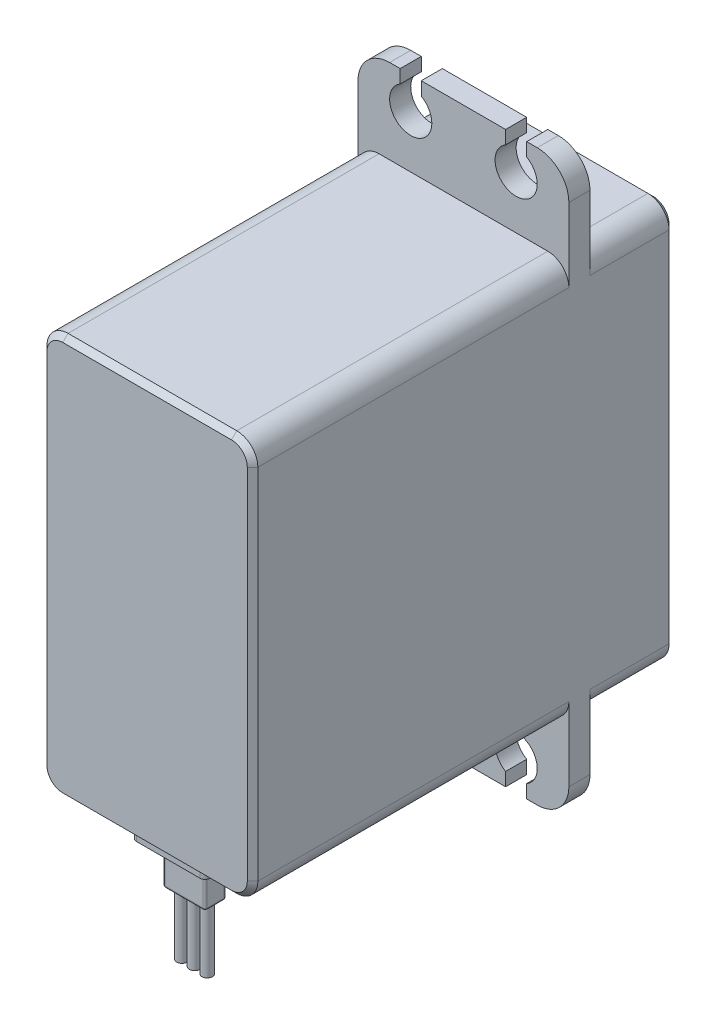
from build123d import *

# Parameters (mm, degrees)
SKETCH_1_W           = 20
SKETCH_1_H           = 54
EXTRUDE_1_DEPTH      = 40
SKETCH_2_OUTSIDE_W   = 36.022
SKETCH_2_OUTSIDE_H   = 70.022
SKETCH_2_OUTSIDE_W_2 = 20
SKETCH_2_OUTSIDE_H_2 = 38
CUT_EXTRUDE_1_DEPTH  = 30
SKETCH_3_OUTSIDE_W   = 36.022
SKETCH_3_OUTSIDE_H   = 70.022
SKETCH_3_OUTSIDE_W_2 = 20
SKETCH_3_OUTSIDE_H_2 = 38
CUT_EXTRUDE_2_DEPTH  = 8
CUT_EXTRUDE_3_DEPTH  = 42.581245773
SKETCH_6_W           = 7
SKETCH_6_H           = 5
EXTRUDE_2_DEPTH      = 2
SKETCH_7_W           = 4
SKETCH_7_H           = 2
EXTRUDE_3_DEPTH      = 4
SKETCH_8_R           = 0.5
EXTRUDE_4_DEPTH      = 6
SKETCH_9_R           = 6.5
EXTRUDE_5_DEPTH      = 2
SKETCH_10_R          = 5
CUT_EXTRUDE_4_DEPTH  = 0.8
SKETCH_11_R          = 2.5
CUT_EXTRUDE_5_DEPTH  = 4
SKETCH_12_R          = 2.5
EXTRUDE_6_DEPTH      = 10
CUT_EXTRUDE_6_DEPTH  = 58.348408871
FILLET_1_R           = 2
CHAMFER_1_SIZE       = 0.5
FILLET_2_R           = 3
FILLET_3_R           = 0.5
FILLET_4_R           = 0.2


with BuildPart() as part:
    # 草图1 → 凸台-拉伸1 (new body)
    with BuildSketch(Plane.XY):
        Rectangle(SKETCH_1_W, SKETCH_1_H)
    extrude(amount=EXTRUDE_1_DEPTH)

    # 草图2 outside → 切除-拉伸1 (cut)
    with BuildSketch(Plane.XY.offset(40)):
        Rectangle(SKETCH_2_OUTSIDE_W, SKETCH_2_OUTSIDE_H)
        Rectangle(SKETCH_2_OUTSIDE_W_2, SKETCH_2_OUTSIDE_H_2, mode=Mode.SUBTRACT)
    extrude(amount=-CUT_EXTRUDE_1_DEPTH, mode=Mode.SUBTRACT)

    # 草图3 outside → 切除-拉伸2 (cut)
    with BuildSketch(Plane(origin=(0, 0, 0), x_dir=(-1, 0, 0), z_dir=(0, 0, -1))):
        Rectangle(SKETCH_3_OUTSIDE_W, SKETCH_3_OUTSIDE_H)
        Rectangle(SKETCH_3_OUTSIDE_W_2, SKETCH_3_OUTSIDE_H_2, mode=Mode.SUBTRACT)
    extrude(amount=-CUT_EXTRUDE_2_DEPTH, mode=Mode.SUBTRACT)

    # 草图4 → 切除-拉伸3 (cut, through all)
    with BuildSketch(Plane.XY.offset(10)):
        with BuildLine():
            Line((4, 25.732050808), (4, 27))
            Line((4, 27), (6, 27))
            Line((6, 27), (6, 25.732050808))
            ThreePointArc((6, 25.732050808), (5, 22), (4, 25.732050808))
        make_face()
        with BuildLine():
            Line((-6, 25.732050808), (-6, 27))
            Line((-6, 27), (-4, 27))
            Line((-4, 27), (-4, 25.732050808))
            ThreePointArc((-4, 25.732050808), (-5, 22), (-6, 25.732050808))
        make_face()
    cut_extrude_3 = extrude(amount=-CUT_EXTRUDE_3_DEPTH, mode=Mode.SUBTRACT)

    # 镜向1: 切除-拉伸3 across plane
    add(cut_extrude_3.mirror(Plane.ZX), mode=Mode.SUBTRACT)

    # 草图6 → 凸台-拉伸2 (add)
    with BuildSketch(Plane.XZ.offset(19)):
        with Locations((0, 35.5)):
            Rectangle(SKETCH_6_W, SKETCH_6_H)
    extrude(amount=EXTRUDE_2_DEPTH)

    # 草图7 → 凸台-拉伸3 (add)
    with BuildSketch(Plane.XZ.offset(21)):
        with Locations((0, 35.5)):
            Rectangle(SKETCH_7_W, SKETCH_7_H)
    extrude(amount=EXTRUDE_3_DEPTH)

    # 草图8 → 凸台-拉伸4 (add)
    with BuildSketch(Plane.XZ.offset(25)):
        with Locations(Location((1.2, 35.5, 0), (0, 0, 90))):
            Circle(SKETCH_8_R)
        with Locations(Location((0, 35.5, 0), (0, 0, 90))):
            Circle(SKETCH_8_R)
        with Locations(Location((-1.2, 35.5, 0), (0, 0, 90))):
            Circle(SKETCH_8_R)
    extrude(amount=EXTRUDE_4_DEPTH)

    # 草图9 → 凸台-拉伸5 (add)
    with BuildSketch(Plane(origin=(0, 0, 0), x_dir=(-1, 0, 0), z_dir=(0, 0, -1))):
        with Locations((0, -9)):
            Circle(SKETCH_9_R)
    extrude(amount=EXTRUDE_5_DEPTH)

    # 草图10 → 切除-拉伸4 (cut)
    with BuildSketch(Plane(origin=(0, 0, -2), x_dir=(-1, 0, 0), z_dir=(0, 0, -1))):
        with Locations((0, -9)):
            Circle(SKETCH_10_R)
    extrude(amount=-CUT_EXTRUDE_4_DEPTH, mode=Mode.SUBTRACT)

    # 草图11 → 切除-拉伸5 (cut)
    with BuildSketch(Plane(origin=(0, 0, -1.2), x_dir=(-1, 0, 0), z_dir=(0, 0, -1))):
        with Locations((0, -9)):
            Circle(SKETCH_11_R)
    extrude(amount=-CUT_EXTRUDE_5_DEPTH, mode=Mode.SUBTRACT)

    # 圆角1
    fillet_1_edges = [part.edges().sort_by_distance(p)[0] for p in [
        (10, -19, 25),
        (-10, -19, 25),
        (-10, 19, 25),
        (10, 19, 25),
        (-10, -19, 4),
        (10, -19, 4),
        (10, 19, 4),
        (-10, 19, 4),
    ]]
    fillet(fillet_1_edges, radius=FILLET_1_R)

    # 倒角1
    chamfer_1_edges = [part.edges().sort_by_distance(p)[0] for p in [
        (6.5, -9, -2),
        (0, -19, 0),
        (10, 0, 0),
        (-10, 0, 0),
        (0, 19, 0),
        (9.414213562, 18.414213562, 0),
        (-9.414213562, 18.414213562, 0),
        (9.414213562, -18.414213562, 0),
        (-9.414213562, -18.414213562, 0),
        (-10, 0, 40),
        (0, -19, 40),
        (10, 0, 40),
        (0, 19, 40),
        (9.414213562, 18.414213562, 40),
        (-9.414213562, 18.414213562, 40),
        (9.414213562, -18.414213562, 40),
        (-9.414213562, -18.414213562, 40),
    ]]
    chamfer(chamfer_1_edges, length=CHAMFER_1_SIZE)

    # 圆角2
    fillet_2_edges = [part.edges().sort_by_distance(p)[0] for p in [
        (10, -27, 9),
        (-10, -27, 9),
        (-10, 27, 9),
        (10, 27, 9),
    ]]
    fillet(fillet_2_edges, radius=FILLET_2_R)

    # 圆角3
    fillet_3_edges = [part.edges().sort_by_distance(p)[0] for p in [
        (-3.5, -20, 38),
        (-3.5, -20, 33),
        (3.5, -20, 33),
        (3.5, -20, 38),
    ]]
    fillet(fillet_3_edges, radius=FILLET_3_R)

    # 圆角4
    fillet_4_edges = [part.edges().sort_by_distance(p)[0] for p in [
        (2, -23, 34.5),
        (2, -23, 36.5),
        (-2, -23, 36.5),
        (-2, -23, 34.5),
        (2, -25, 35.5),
        (0, -25, 36.5),
        (-2, -25, 35.5),
        (0, -25, 34.5),
    ]]
    fillet(fillet_4_edges, radius=FILLET_4_R)


with BuildPart() as body_2:
    # 草图12 → 凸台-拉伸6 (new body)
    with BuildSketch(Plane(origin=(0, 0, 2.8), x_dir=(-1, 0, 0), z_dir=(0, 0, -1))):
        with Locations((0, -9)):
            Circle(SKETCH_12_R)
    extrude(amount=EXTRUDE_6_DEPTH)

    # 草图13 → 切除-拉伸6 (cut, through all)
    with BuildSketch(Plane(origin=(0, 0, -7.2), x_dir=(-1, 0, 0), z_dir=(0, 0, -1))):
        with BuildLine():
            Line((-0.27961852, -6.515686517), (0, -7))
            Line((0, -7), (0.27961852, -6.515686517))
            ThreePointArc((0.27961852, -6.515686517), (0, -6.5), (-0.27961852, -6.515686517))
        make_face()
        with BuildLine():
            Line((0.50176207, -6.550870599), (0.618033989, -7.097886967))
            Line((0.618033989, -7.097886967), (1.033628101, -6.723684348))
            ThreePointArc((1.033628101, -6.723684348), (0.772542486, -6.622358709), (0.50176207, -6.550870599))
        make_face()
        with BuildLine():
            Line((1.234026693, -6.82579253), (1.175570505, -7.381966011))
            Line((1.175570505, -7.381966011), (1.686458962, -7.154503815))
            ThreePointArc((1.686458962, -7.154503815), (1.469463131, -6.977457514), (1.234026693, -6.82579253))
        make_face()
        with BuildLine():
            Line((1.845496185, -7.313541038), (1.618033989, -7.824429495))
            Line((1.618033989, -7.824429495), (2.17420747, -7.765973307))
            ThreePointArc((2.17420747, -7.765973307), (2.022542486, -7.530536869), (1.845496185, -7.313541038))
        make_face()
        with BuildLine():
            Line((2.276315652, -7.966371899), (1.902113033, -8.381966011))
            Line((1.902113033, -8.381966011), (2.449129401, -8.49823793))
            ThreePointArc((2.449129401, -8.49823793), (2.377641291, -8.227457514), (2.276315652, -7.966371899))
        make_face()
        with BuildLine():
            Line((2.484313483, -8.72038148), (2, -9))
            Line((2, -9), (2.484313483, -9.27961852))
            ThreePointArc((2.484313483, -9.27961852), (2.5, -9), (2.484313483, -8.72038148))
        make_face()
        with BuildLine():
            Line((2.449129401, -9.50176207), (1.902113033, -9.618033989))
            Line((1.902113033, -9.618033989), (2.276315652, -10.033628101))
            ThreePointArc((2.276315652, -10.033628101), (2.377641291, -9.772542486), (2.449129401, -9.50176207))
        make_face()
        with BuildLine():
            Line((2.17420747, -10.234026693), (1.618033989, -10.175570505))
            Line((1.618033989, -10.175570505), (1.845496185, -10.686458962))
            ThreePointArc((1.845496185, -10.686458962), (2.022542486, -10.469463131), (2.17420747, -10.234026693))
        make_face()
        with BuildLine():
            Line((1.686458962, -10.845496185), (1.175570505, -10.618033989))
            Line((1.175570505, -10.618033989), (1.234026693, -11.17420747))
            ThreePointArc((1.234026693, -11.17420747), (1.469463131, -11.022542486), (1.686458962, -10.845496185))
        make_face()
        with BuildLine():
            Line((1.033628101, -11.276315652), (0.618033989, -10.902113033))
            Line((0.618033989, -10.902113033), (0.50176207, -11.449129401))
            ThreePointArc((0.50176207, -11.449129401), (0.772542486, -11.377641291), (1.033628101, -11.276315652))
        make_face()
        with BuildLine():
            Line((0.27961852, -11.484313483), (0, -11))
            Line((0, -11), (-0.27961852, -11.484313483))
            ThreePointArc((-0.27961852, -11.484313483), (0, -11.5), (0.27961852, -11.484313483))
        make_face()
        with BuildLine():
            Line((-0.50176207, -11.449129401), (-0.618033989, -10.902113033))
            Line((-0.618033989, -10.902113033), (-1.033628101, -11.276315652))
            ThreePointArc((-1.033628101, -11.276315652), (-0.772542486, -11.377641291), (-0.50176207, -11.449129401))
        make_face()
        with BuildLine():
            Line((-1.234026693, -11.17420747), (-1.175570505, -10.618033989))
            Line((-1.175570505, -10.618033989), (-1.686458962, -10.845496185))
            ThreePointArc((-1.686458962, -10.845496185), (-1.469463131, -11.022542486), (-1.234026693, -11.17420747))
        make_face()
        with BuildLine():
            Line((-1.845496185, -10.686458962), (-1.618033989, -10.175570505))
            Line((-1.618033989, -10.175570505), (-2.17420747, -10.234026693))
            ThreePointArc((-2.17420747, -10.234026693), (-2.022542486, -10.469463131), (-1.845496185, -10.686458962))
        make_face()
        with BuildLine():
            Line((-2.276315652, -10.033628101), (-1.902113033, -9.618033989))
            Line((-1.902113033, -9.618033989), (-2.449129401, -9.50176207))
            ThreePointArc((-2.449129401, -9.50176207), (-2.377641291, -9.772542486), (-2.276315652, -10.033628101))
        make_face()
        with BuildLine():
            Line((-2.484313483, -9.27961852), (-2, -9))
            Line((-2, -9), (-2.484313483, -8.72038148))
            ThreePointArc((-2.484313483, -8.72038148), (-2.5, -9), (-2.484313483, -9.27961852))
        make_face()
        with BuildLine():
            Line((-2.449129401, -8.49823793), (-1.902113033, -8.381966011))
            Line((-1.902113033, -8.381966011), (-2.276315652, -7.966371899))
            ThreePointArc((-2.276315652, -7.966371899), (-2.377641291, -8.227457514), (-2.449129401, -8.49823793))
        make_face()
        with BuildLine():
            Line((-2.17420747, -7.765973307), (-1.618033989, -7.824429495))
            Line((-1.618033989, -7.824429495), (-1.845496185, -7.313541038))
            ThreePointArc((-1.845496185, -7.313541038), (-2.022542486, -7.530536869), (-2.17420747, -7.765973307))
        make_face()
        with BuildLine():
            Line((-1.686458962, -7.154503815), (-1.175570505, -7.381966011))
            Line((-1.175570505, -7.381966011), (-1.234026693, -6.82579253))
            ThreePointArc((-1.234026693, -6.82579253), (-1.469463131, -6.977457514), (-1.686458962, -7.154503815))
        make_face()
        with BuildLine():
            Line((-1.033628101, -6.723684348), (-0.618033989, -7.097886967))
            Line((-0.618033989, -7.097886967), (-0.50176207, -6.550870599))
            ThreePointArc((-0.50176207, -6.550870599), (-0.772542486, -6.622358709), (-1.033628101, -6.723684348))
        make_face()
    extrude(amount=-CUT_EXTRUDE_6_DEPTH, mode=Mode.SUBTRACT)

    # 草图14 → 切除-旋转1 (revolve, cut)
    with BuildSketch(Plane(origin=(0, 0, 0), x_dir=(0, 0, -1), z_dir=(1, 0, 0))):
        Polygon((7.2, -7), (7.2, -6), (6.622649731, -6), align=None)
    cut_revolve_1 = revolve(axis=Axis((0, -9, -7.2), (0, 0, 1)), mode=Mode.SUBTRACT)

    # 镜向2: 切除-旋转1 across plane
    add(cut_revolve_1.mirror(Plane.XY.offset(-2.2)), mode=Mode.SUBTRACT)


with BuildPart() as hole_wizard_m2_2_tool:
    # 草图17 → M2 螺纹孔2 (revolve)
    with BuildSketch(Plane(origin=(0, -9, -7.2), x_dir=(0, 1, 0), z_dir=(1, 0, 0))):
        Polygon((0, 0), (0, 10.480688495), (0.8, 10), (0.8, 0), align=None)
    revolve(axis=Axis((0, -9, -13.55), (0, 0, 1)))


with BuildPart() as part_1:
    add(part.part)

    # M2 螺纹孔2: cut by hole_wizard_m2_2_tool
    add(hole_wizard_m2_2_tool.part, mode=Mode.SUBTRACT)


with BuildPart() as body_2_1:
    add(body_2.part)

    # M2 螺纹孔2: cut by hole_wizard_m2_2_tool
    add(hole_wizard_m2_2_tool.part, mode=Mode.SUBTRACT)


solid = Compound([part_1.part, body_2_1.part])
